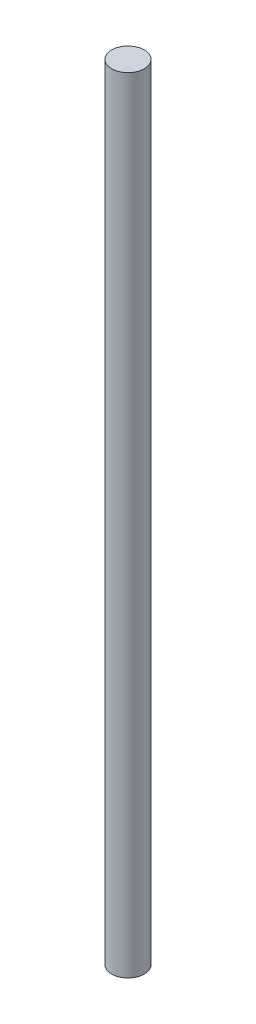
from build123d import *

# Parameters (mm, degrees)
SKETCH1_R           = 9.525
BOSS_EXTRUDE1_DEPTH = 457.2


with BuildPart() as part:
    # Sketch1 → Boss-Extrude1 (new body)
    with BuildSketch(Plane(origin=(0, 0, 0), x_dir=(1, 0, 0), z_dir=(0, 1, 0))):
        with Locations(Location((0, 0, 0), (0, 0, 270))):
            Circle(SKETCH1_R)
    extrude(amount=BOSS_EXTRUDE1_DEPTH)


solid = part.part
